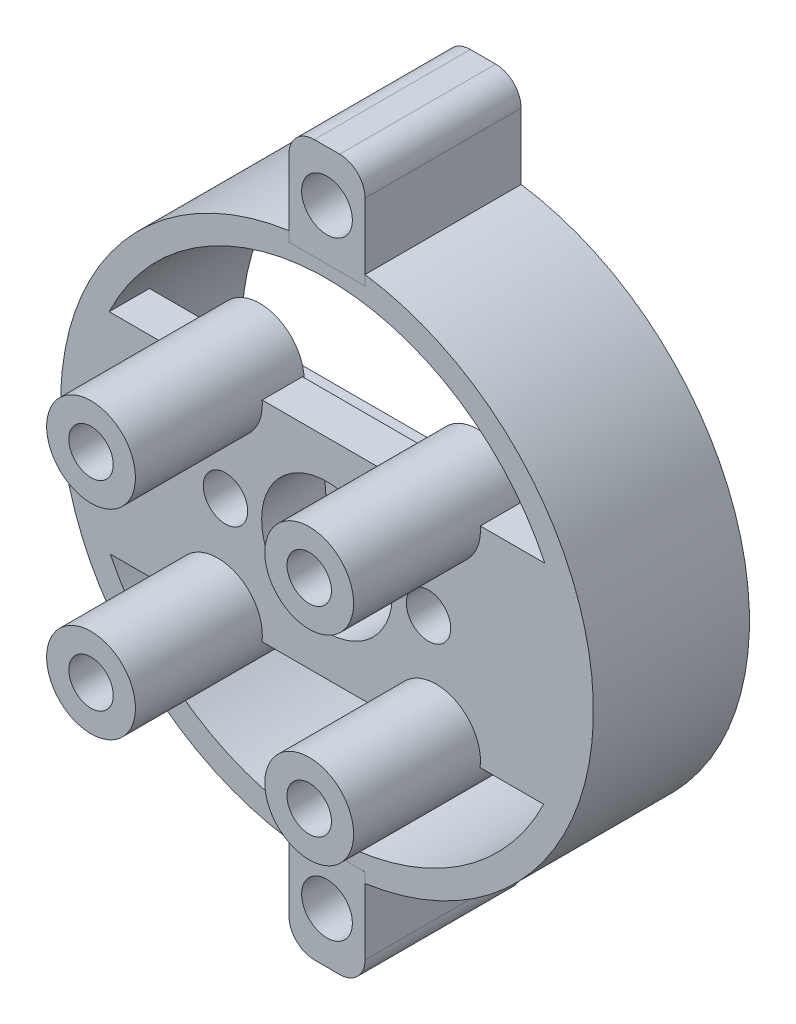
from build123d import *

# Parameters (mm, degrees)
SKETCH1_R               = 21
SKETCH1_R_2             = 19.01
BOSS_EXTRUDE1_DEPTH     = 12.3
BOSS_EXTRUDE3_START     = -3.175
SKETCH4_W               = 16.5
SKETCH4_H               = 16.5
BOSS_EXTRUDE3_DEPTH     = 3.175
SKETCH8_W               = 29.000689647
SKETCH8_H               = 11.495244731
SKETCH8_R               = 2.5875
BOSS_EXTRUDE4_DEPTH     = 3
CUT_EXTRUDE2_DEPTH      = 33.144828511
CUT_EXTRUDE2_DEPTH_BACK = 5
SKETCH7_R               = 5.15
SKETCH11_R              = 1.75
CUT_EXTRUDE21_DEPTH     = 29
BOSS_EXTRUDE5_START     = -12.3
SKETCH12_W              = 6
SKETCH12_H              = 8
SKETCH12_R              = 2
BOSS_EXTRUDE5_DEPTH     = 12.3001
FILLET1_R               = 2
BOSS_EXTRUDE6_START     = -3.3
SKETCH13_R              = 3.5
BOSS_EXTRUDE6_DEPTH     = 13.3
SKETCH14_R              = 1.75
CUT_EXTRUDE22_DEPTH     = 20.3
MIRROR7_START           = -3.3
MIRROR7_COPY_1_SKETCH_R = 3.5
MIRROR7_COPY_1_DEPTH    = 13.3
MIRROR7_COPY_2_SKETCH_R = 1.75
MIRROR7_COPY_2_DEPTH    = 20.3


with BuildPart() as part:
    # Sketch1 → Boss-Extrude1 (new body)
    with BuildSketch(Plane.XY):
        Circle(SKETCH1_R)
        Circle(SKETCH1_R_2, mode=Mode.SUBTRACT)
    extrude(amount=BOSS_EXTRUDE1_DEPTH)

    # Sketch4 → Boss-Extrude3 (add)
    with BuildSketch(Plane.XY.offset(12.3).offset(BOSS_EXTRUDE3_START)):
        with BuildLine():
            ThreePointArc((19.01, 0), (18.543691139, 4.184688632), (17.167641352, 8.164079275))
            Line((17.167641352, 8.164079275), (8.267129889, 8.164079275))
            Line((8.267129889, 8.164079275), (8.267129889, -8.335920725))
            Line((8.267129889, -8.335920725), (17.084862471, -8.335920725))
            ThreePointArc((17.084862471, -8.335920725), (18.522463869, -4.277666678), (19.01, 0))
        make_face()
        with Locations((0.017129889, -0.085920725)):
            Rectangle(SKETCH4_W, SKETCH4_H)
        with BuildLine():
            Line((-8.232870111, 8.164079275), (-17.167641352, 8.164079275))
            ThreePointArc((-17.167641352, 8.164079275), (-19.00976077, -0.095370104), (-17.084862471, -8.335920725))
            Line((-17.084862471, -8.335920725), (-8.232870111, -8.335920725))
            Line((-8.232870111, -8.335920725), (-8.232870111, 8.164079275))
        make_face()
    extrude(amount=BOSS_EXTRUDE3_DEPTH)

    # Sketch8 → Boss-Extrude4 (add)
    with BuildSketch(Plane.XY.offset(9.125)):
        with Locations((-0.119782029, 0.187903113)):
            Rectangle(SKETCH8_W, SKETCH8_H)
        with Locations((-0.11978203, 0.187903113)):
            Circle(SKETCH8_R, mode=Mode.SUBTRACT)
    extrude(amount=-BOSS_EXTRUDE4_DEPTH)

    # Sketch7 → Cut-Extrude2 (cut, two sides: drawn at the far end of the back side and taken through both)
    with BuildSketch(Plane.XY.offset(12.3).offset(-CUT_EXTRUDE2_DEPTH_BACK)):
        with Locations(Location((0, 0, 0), (0, 0, 180))):
            Circle(SKETCH7_R)
    extrude(amount=CUT_EXTRUDE2_DEPTH + CUT_EXTRUDE2_DEPTH_BACK, mode=Mode.SUBTRACT)

    # Sketch11 → Cut-Extrude21 (cut)
    with BuildSketch(Plane(origin=(0, 0, 12.3), x_dir=(-1, 0, 0), z_dir=(0, 0, -1))):
        with Locations((-8, 0)):
            Circle(SKETCH11_R)
    cut_extrude21 = extrude(amount=CUT_EXTRUDE21_DEPTH, mode=Mode.SUBTRACT)

    # Mirror1: Cut-Extrude21 across plane
    add(cut_extrude21.mirror(Plane(origin=(0, 0, 0), x_dir=(0, 0, 1), z_dir=(1, 0, 0))), mode=Mode.SUBTRACT)

    # Sketch12 → Boss-Extrude5 (add)
    with BuildSketch(Plane.XY.offset(12.3).offset(BOSS_EXTRUDE5_START)):
        with Locations((0, 24)):
            Rectangle(SKETCH12_W, SKETCH12_H)
        with Locations((0, 24)):
            Circle(SKETCH12_R, mode=Mode.SUBTRACT)
    boss_extrude5 = extrude(amount=BOSS_EXTRUDE5_DEPTH)

    # Mirror3: Boss-Extrude5 across plane
    add(boss_extrude5.mirror(Plane.ZX))

    # Fillet1
    fillet1_edges = [part.edges().sort_by_distance(p)[0] for p in [
        (3, 28, 6.15005),
        (-3, 28, 6.15005),
        (-3, -28, 6.15005),
        (3, -28, 6.15005),
    ]]
    fillet(fillet1_edges, radius=FILLET1_R)

    # Sketch13 → Boss-Extrude6 (add)
    with BuildSketch(Plane.XY.offset(12.3).offset(BOSS_EXTRUDE6_START)):
        with Locations((-8.599008806, -7.871395295)):
            Circle(SKETCH13_R)
    boss_extrude6 = extrude(amount=BOSS_EXTRUDE6_DEPTH)

    # Sketch14 → Cut-Extrude22 (cut)
    with BuildSketch(Plane.XY.offset(22.3)):
        with Locations((-8.599008806, -7.871395295)):
            Circle(SKETCH14_R)
    cut_extrude22 = extrude(amount=-CUT_EXTRUDE22_DEPTH, mode=Mode.SUBTRACT)

    # Mirror5: Boss-Extrude6 across plane
    add(boss_extrude6.mirror(Plane(origin=(0, 0, 0), x_dir=(0, 0, 1), z_dir=(1, 0, 0))))

    # Mirror6: Cut-Extrude22 across plane
    add(cut_extrude22.mirror(Plane(origin=(0, 0, 0), x_dir=(0, 0, 1), z_dir=(1, 0, 0))), mode=Mode.SUBTRACT)

    # Mirror7: Boss-Extrude6, Cut-Extrude22 across plane
    add(boss_extrude6.mirror(Plane.ZX))
    add(cut_extrude22.mirror(Plane.ZX), mode=Mode.SUBTRACT)

    # Mirror7 copy 1 sketch → Mirror7 copy 1 (add)
    with BuildSketch(Plane(origin=(0, 0, 12.3), x_dir=(-1, 0, 0), z_dir=(0, 0, 1)).offset(MIRROR7_START)):
        with Locations((-8.599008806, -7.871395295)):
            Circle(MIRROR7_COPY_1_SKETCH_R)
    extrude(amount=MIRROR7_COPY_1_DEPTH)

    # Mirror7 copy 2 sketch → Mirror7 copy 2 (cut)
    with BuildSketch(Plane(origin=(0, 0, 22.3), x_dir=(-1, 0, 0), z_dir=(0, 0, 1))):
        with Locations((-8.599008806, -7.871395295)):
            Circle(MIRROR7_COPY_2_SKETCH_R)
    extrude(amount=-MIRROR7_COPY_2_DEPTH, mode=Mode.SUBTRACT)


solid = part.part
